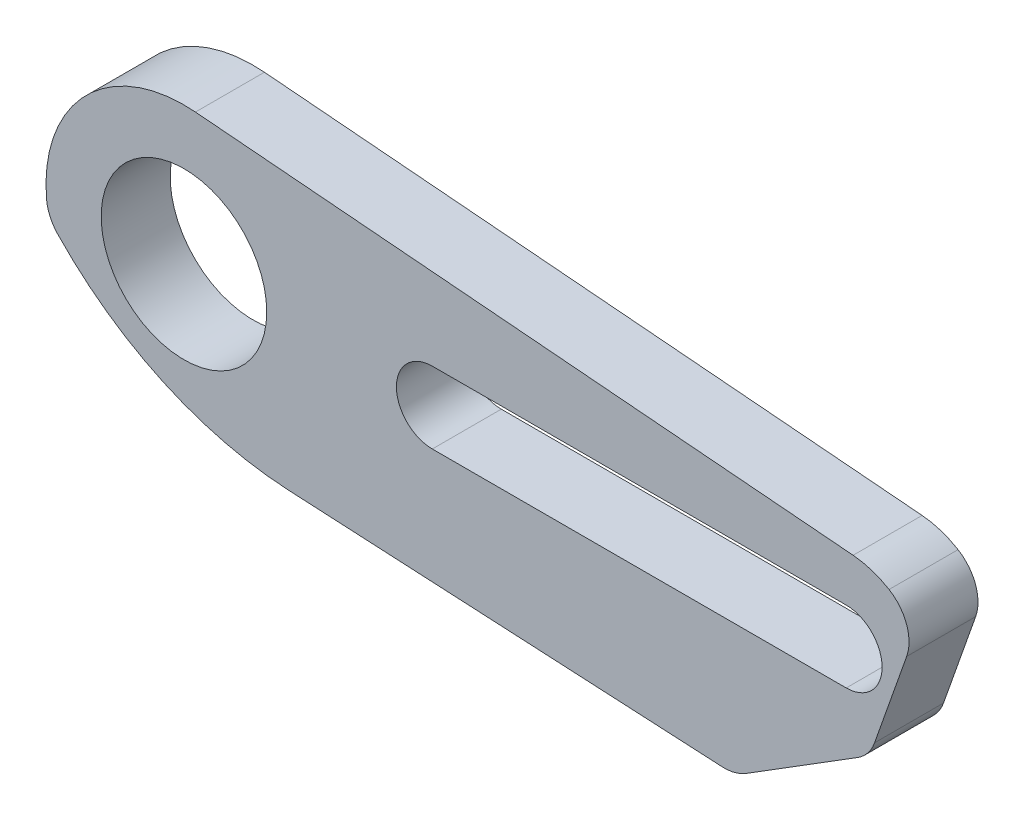
from build123d import *

# Parameters (mm, degrees)
SKETCH_1_R          = 3
EXTRUDE_1_DEPTH     = 2.5
CUT_EXTRUDE_START   = -2.5
CUT_EXTRUDE_2_DEPTH = 2.5
CUT_EXTRUDE_START_2 = -20
CUT_EXTRUDE_3_DEPTH = 20
FILLET_2_R          = 1.5


with BuildPart() as part:
    # 草图1 → 凸台-拉伸1 (new body)
    with BuildSketch(Plane.XY):
        with BuildLine():
            ThreePointArc((0.416666667, 4.982608643), (-4.995650269, 0.20851473), (0, -5))
            Line((0, -5), (19.972590695, -6.046719125))
            Line((19.972590695, -6.046719125), (25.587337922, -2.545654792))
            ThreePointArc((25.587337922, -2.545654792), (26.916096314, 0.704544029), (24.25, 2.989565186))
            Line((24.25, 2.989565186), (0.416666667, 4.982608643))
        make_face()
        Circle(SKETCH_1_R, mode=Mode.SUBTRACT)
        with BuildLine():
            ThreePointArc((9, -1.3), (7.7, 0), (9, 1.3))
            Line((9, 1.3), (24, 1.3))
            ThreePointArc((24, 1.3), (25.3, 0), (24, -1.3))
            Line((24, -1.3), (9, -1.3))
        make_face(mode=Mode.SUBTRACT)
    extrude(amount=EXTRUDE_1_DEPTH)

    # 草图2 → 切除-拉伸2 (cut)
    with BuildSketch(Plane.XY.offset(2.5).offset(CUT_EXTRUDE_START)):
        with BuildLine():
            Line((24.851438624, -3.004523319), (25.587337922, -2.545654792))
            ThreePointArc((25.587337922, -2.545654792), (26.931709032, -0.636460643), (26.5, 1.658312395))
            Line((26.5, 1.658312395), (24.851438624, -3.004523319))
        make_face()
    extrude(amount=CUT_EXTRUDE_2_DEPTH, mode=Mode.SUBTRACT)

    # 草图3 → 切除-拉伸3 (cut)
    with BuildSketch(Plane.XY.offset(2.5).offset(CUT_EXTRUDE_START_2)):
        with BuildLine():
            ThreePointArc((-4.900680589, -0.991629852), (-3.165584523, -3.87028095), (0, -5))
            Line((0, -5), (3.814269781, -5.199897409))
            ThreePointArc((3.814269781, -5.199897409), (-0.9669941, -3.973392585), (-4.900680589, -0.991629852))
        make_face()
    extrude(amount=CUT_EXTRUDE_3_DEPTH, mode=Mode.SUBTRACT)

    # 圆角2
    fillet_2_edges = [part.edges().sort_by_distance(p)[0] for p in [
        (19.972590695, -6.046719125, 1.25),
        (26.5, 1.658312395, 1.25),
        (24.851438624, -3.004523319, 1.25),
        (-4.900680589, -0.991629852, 1.25),
    ]]
    fillet(fillet_2_edges, radius=FILLET_2_R)


solid = part.part
